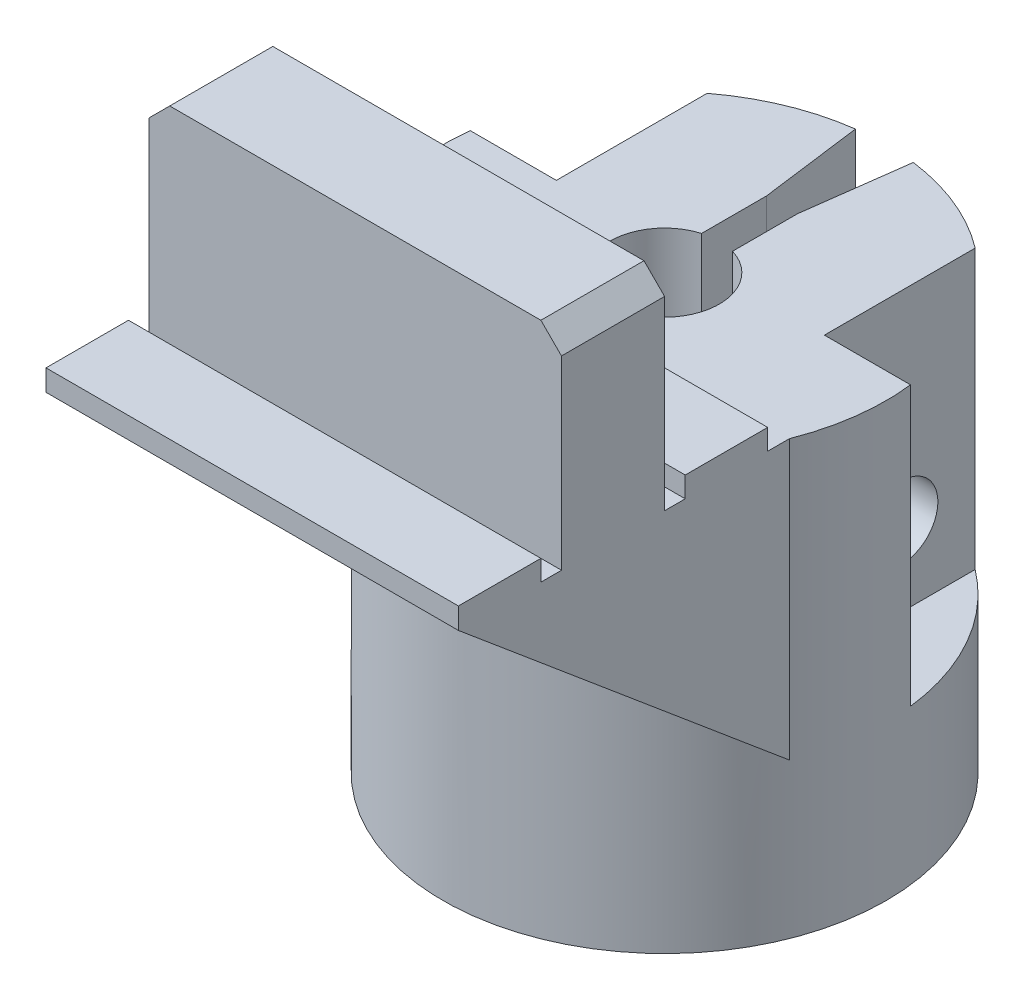
from build123d import *

# Parameters (mm, degrees)
SKICA1_R                      = 10.75
SKICA1_R_2                    = 2.65
P_IDAT_VYSUNUT_M1_DEPTH       = 21
ODEBRAT_VYSUNUT_M1_DEPTH      = 26.925373671
ODEBRAT_VYSUNUT_M1_DEPTH_BACK = 26.925373671
SKICA2_W                      = 1.5
SKICA2_H                      = 14.75
ODEBRAT_START                 = -13.5
ODEBRAT_VYSUNUT_M2_DEPTH      = 13.5
SKICA5_R                      = 1.75
ODEBRAT_VYSUNUT_M3_DEPTH      = 30.22541702
P_IDAT_VYSUNUT_M3_DEPTH       = 10
SKICA2_2_W                    = 1.5
SKICA2_2_H                    = 14.75
ODEBRAT_VYSUNUT_M4_DEPTH      = 28.95643933
P_IDAT_VYSUNUT_M6_DEPTH       = 20
ZKOSEN_1_SIZE                 = 1
SKICA9_W                      = 20
SKICA9_H                      = 2.57342531
SKICA9_H_2                    = 5
P_IDAT_VYSUNUT_M5_DEPTH       = 1
SKICA11_W                     = 1.5
SKICA11_H                     = 1
ODEBRAT_VYSUNUT_M5_DEPTH      = 30.41747401
ODEBRAT_VYSUNUT_M6_DEPTH      = 30.41747401
P_IDAT_VYSUNUT_M7_DEPTH       = 20
SKICA15_W                     = 1
SKICA15_H                     = 1
ODEBRAT_VYSUNUT_M8_DEPTH      = 43.326853179


with BuildPart() as part:
    # Skica1 → Přidat vysunutím1 (new body)
    with BuildSketch(Plane(origin=(0, 0, 0), x_dir=(1, 0, 0), z_dir=(0, 1, 0))):
        with Locations(Location((0, 0, 0), (0, 0, 90))):
            Circle(SKICA1_R)
        with Locations(Location((0, 0, 0), (0, 0, 90))):
            Circle(SKICA1_R_2, mode=Mode.SUBTRACT)
    extrude(amount=P_IDAT_VYSUNUT_M1_DEPTH)

    # Skica2 → Odebrat vysunutím1 (cut, two sides: drawn at the far end of the back side and taken through both)
    with BuildSketch(Plane(origin=(0, 21, 0), x_dir=(1, 0, 0), z_dir=(0, 1, 0)).offset(-ODEBRAT_VYSUNUT_M1_DEPTH_BACK)):
        with Locations((0, 3.375)):
            Rectangle(SKICA2_W, SKICA2_H)
    extrude(amount=ODEBRAT_VYSUNUT_M1_DEPTH + ODEBRAT_VYSUNUT_M1_DEPTH_BACK, mode=Mode.SUBTRACT)

    # Skica4 → Odebrat vysunutím2 (cut)
    with BuildSketch(Plane(origin=(0, 21, 0), x_dir=(1, 0, 0), z_dir=(0, 1, 0)).offset(ODEBRAT_START)):
        with BuildLine():
            ThreePointArc((-6.5, 8.562271895), (-9.334363095, 5.332182069), (-10.677078252, 1.25))
            Line((-10.677078252, 1.25), (-6.5, 1.25))
            Line((-6.5, 1.25), (-6.5, 8.562271895))
        make_face()
        with BuildLine():
            Line((6.5, 1.25), (10.677078252, 1.25))
            ThreePointArc((10.677078252, 1.25), (9.334363095, 5.332182069), (6.5, 8.562271895))
            Line((6.5, 8.562271895), (6.5, 1.25))
        make_face()
    extrude(amount=ODEBRAT_VYSUNUT_M2_DEPTH, mode=Mode.SUBTRACT)

    # Skica5 → Odebrat vysunutím3 (cut, through all)
    with BuildSketch(Plane.ZY.offset(6.5)):
        with Locations((-5, 11.25)):
            Circle(SKICA5_R)
    extrude(amount=-ODEBRAT_VYSUNUT_M3_DEPTH, mode=Mode.SUBTRACT)

    # Skica6 → Přidat vysunutím3 (add, symmetric)
    with BuildSketch(Plane(origin=(0, 0, 0), x_dir=(0, 0, -1), z_dir=(1, 0, 0))):
        Polygon((-15, 31), (-10, 31), (-10, 21), (-3.94493346, 21), (-3.94493346, 7.5), (-15, 16.776302257), align=None)
    extrude(amount=P_IDAT_VYSUNUT_M3_DEPTH, both=True)

    # Skica2<2> → Odebrat vysunutím4 (cut, through all)
    with BuildSketch(Plane(origin=(0, 21, 0), x_dir=(1, 0, 0), z_dir=(0, 1, 0))):
        with Locations((0, 3.375)):
            Rectangle(SKICA2_2_W, SKICA2_2_H)
    extrude(amount=-ODEBRAT_VYSUNUT_M4_DEPTH, mode=Mode.SUBTRACT)

    # Skica8 → Přidat vysunutím6 (add)
    with BuildSketch(Plane(origin=(10, 0, 0), x_dir=(0, 0, -1), z_dir=(1, 0, 0))):
        Polygon((-15, 16.776302257), (-17.57342531, 18.935662485), (-17.57342531, 21), (-15, 21), align=None)
    extrude(amount=-P_IDAT_VYSUNUT_M6_DEPTH)

    # Zkosení1
    zkosen_1_edges = [part.edges().sort_by_distance(p)[0] for p in [
        (10, 31, 12.5),
        (-10, 31, 12.5),
    ]]
    chamfer(zkosen_1_edges, length=ZKOSEN_1_SIZE)

    # Skica9 → Přidat vysunutím5 (add)
    with BuildSketch(Plane(origin=(0, 21, 0), x_dir=(1, 0, 0), z_dir=(0, 1, 0))):
        with Locations((0, -16.286712655)):
            Rectangle(SKICA9_W, SKICA9_H)
        with Locations((0, -7.5)):
            Rectangle(SKICA9_W, SKICA9_H_2)
    extrude(amount=P_IDAT_VYSUNUT_M5_DEPTH)

    # Skica11 → Odebrat vysunutím5 (cut, through all)
    with BuildSketch(Plane(origin=(0, 21, 0), x_dir=(1, 0, 0), z_dir=(0, 1, 0))):
        with Locations((0, -4.5)):
            Rectangle(SKICA11_W, SKICA11_H)
    extrude(amount=-ODEBRAT_VYSUNUT_M5_DEPTH, mode=Mode.SUBTRACT)

    # Skica12 → Odebrat vysunutím6 (cut, through all)
    with BuildSketch(Plane(origin=(0, 21, 0), x_dir=(1, 0, 0), z_dir=(0, 1, 0))):
        Polygon((0, 0), (-1.415264349, 10.75), (1.415264349, 10.75), align=None)
    extrude(amount=-ODEBRAT_VYSUNUT_M6_DEPTH, mode=Mode.SUBTRACT)

    # Skica13 → Přidat vysunutím7 (add)
    with BuildSketch(Plane(origin=(10, 0, 0), x_dir=(0, 0, -1), z_dir=(1, 0, 0))):
        Polygon((-17.57342531, 18.935662485), (-20, 20.971800413), (-20, 22), (-17.57342531, 22), align=None)
    extrude(amount=-P_IDAT_VYSUNUT_M7_DEPTH)

    # Skica15 → Odebrat vysunutím8 (cut, through all)
    with BuildSketch(Plane.ZY.offset(10)):
        with Locations((9.5, 21.5)):
            Rectangle(SKICA15_W, SKICA15_H)
        with Locations((15.5, 21.5)):
            Rectangle(SKICA15_W, SKICA15_H)
    extrude(amount=-ODEBRAT_VYSUNUT_M8_DEPTH, mode=Mode.SUBTRACT)


solid = part.part
